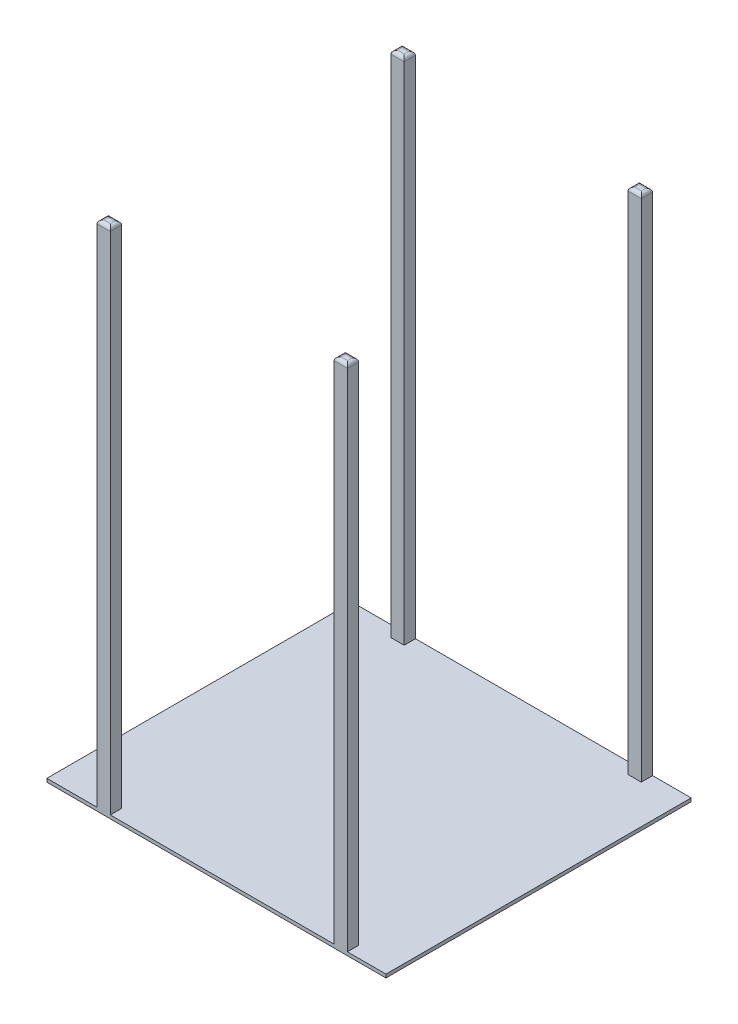
from build123d import *

# Parameters (mm, degrees)
SKETCH1_W           = 1000
SKETCH1_H           = 900
BOSS_EXTRUDE1_DEPTH = 5
SKETCH2_W           = 39.21699111
SKETCH2_H           = 33.368988095
BOSS_EXTRUDE2_DEPTH = 1500
FILLET1_R           = 10


with BuildPart() as part:
    # Sketch1 → Boss-Extrude1 (new, symmetric)
    with BuildSketch(Plane(origin=(0, 0, 0), x_dir=(1, 0, 0), z_dir=(0, 1, 0))):
        Rectangle(SKETCH1_W, SKETCH1_H)
    extrude(amount=BOSS_EXTRUDE1_DEPTH, both=True)

    # Sketch2 → Boss-Extrude2 (add)
    with BuildSketch(Plane(origin=(0, 5, 0), x_dir=(1, 0, 0), z_dir=(0, 1, 0))):
        with Locations((-332.541820244, -433.315505953)):
            Rectangle(SKETCH2_W, SKETCH2_H)
        with Locations((366.675170866, -433.315505953)):
            Rectangle(SKETCH2_W, SKETCH2_H)
        with Locations((366.675170866, 433.315505953)):
            Rectangle(SKETCH2_W, SKETCH2_H)
        with Locations((-332.541820244, 433.315505953)):
            Rectangle(SKETCH2_W, SKETCH2_H)
    extrude(amount=BOSS_EXTRUDE2_DEPTH)

    # Fillet1
    fillet1_edges = [part.edges().sort_by_distance(p)[0] for p in [
        (-352.150315799, 1505, 433.315505952),
        (-332.541820244, 1505, 450),
        (-312.933324689, 1505, 433.315505952),
        (-332.541820244, 1505, 416.631011905),
        (347.066675311, 1505, 433.315505952),
        (366.675170866, 1505, 450),
        (386.283666421, 1505, 433.315505952),
        (366.675170866, 1505, 416.631011905),
        (366.675170866, 1505, -450),
        (347.066675311, 1505, -433.315505952),
        (366.675170866, 1505, -416.631011905),
        (386.283666421, 1505, -433.315505952),
        (-332.541820244, 1505, -450),
        (-352.150315799, 1505, -433.315505952),
        (-332.541820244, 1505, -416.631011905),
        (-312.933324689, 1505, -433.315505952),
    ]]
    fillet(fillet1_edges, radius=FILLET1_R)


solid = part.part
